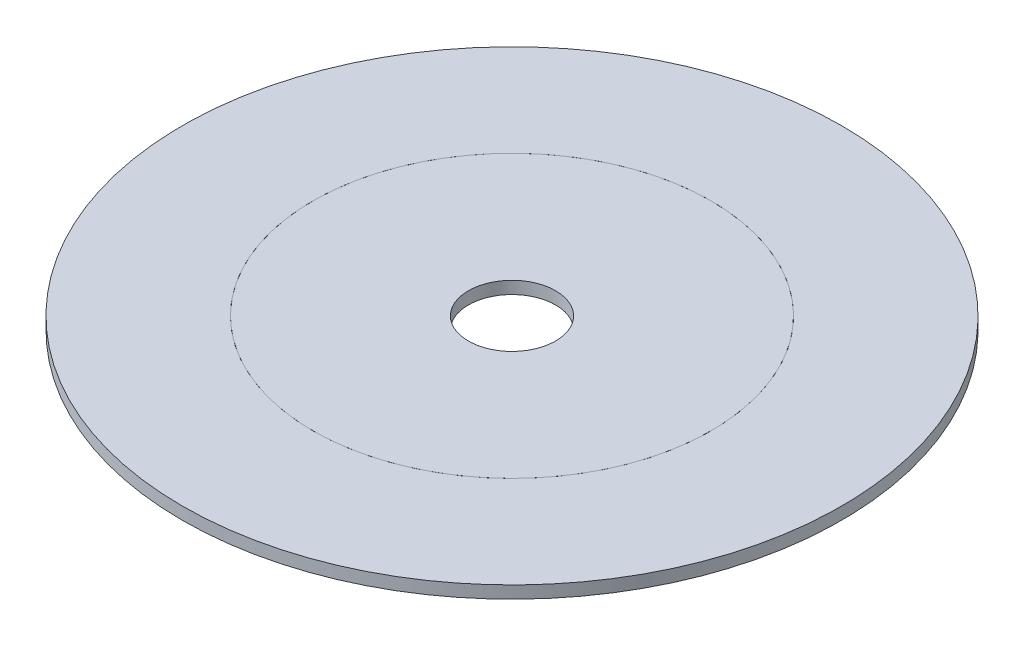
from build123d import *

# Parameters (mm, degrees)
SKETCH1_R           = 24
SKETCH1_R_2         = 14.5
BOSS_EXTRUDE1_DEPTH = 0.9
SKETCH2_R           = 14.5
SKETCH2_R_2         = 3.175
BOSS_EXTRUDE2_DEPTH = 0.9


with BuildPart() as part:
    # Sketch1 → Boss-Extrude1 (new body)
    with BuildSketch(Plane(origin=(0, 0, 0), x_dir=(1, 0, 0), z_dir=(0, 1, 0))):
        with Locations(Location((0, 0, 0), (0, 0, 270))):
            Circle(SKETCH1_R)
        with Locations(Location((0, 0, 0), (0, 0, 270))):
            Circle(SKETCH1_R_2, mode=Mode.SUBTRACT)
    extrude(amount=BOSS_EXTRUDE1_DEPTH)


with BuildPart() as body_2:
    # Sketch2 → Boss-Extrude2 (new body)
    with BuildSketch(Plane.XZ):
        with Locations(Location((0, 0, 0), (0, 0, 270))):
            Circle(SKETCH2_R)
        with Locations(Location((0, 0, 0), (0, 0, 270))):
            Circle(SKETCH2_R_2, mode=Mode.SUBTRACT)
    extrude(amount=-BOSS_EXTRUDE2_DEPTH)


solid = Compound([part.part, body_2.part])
